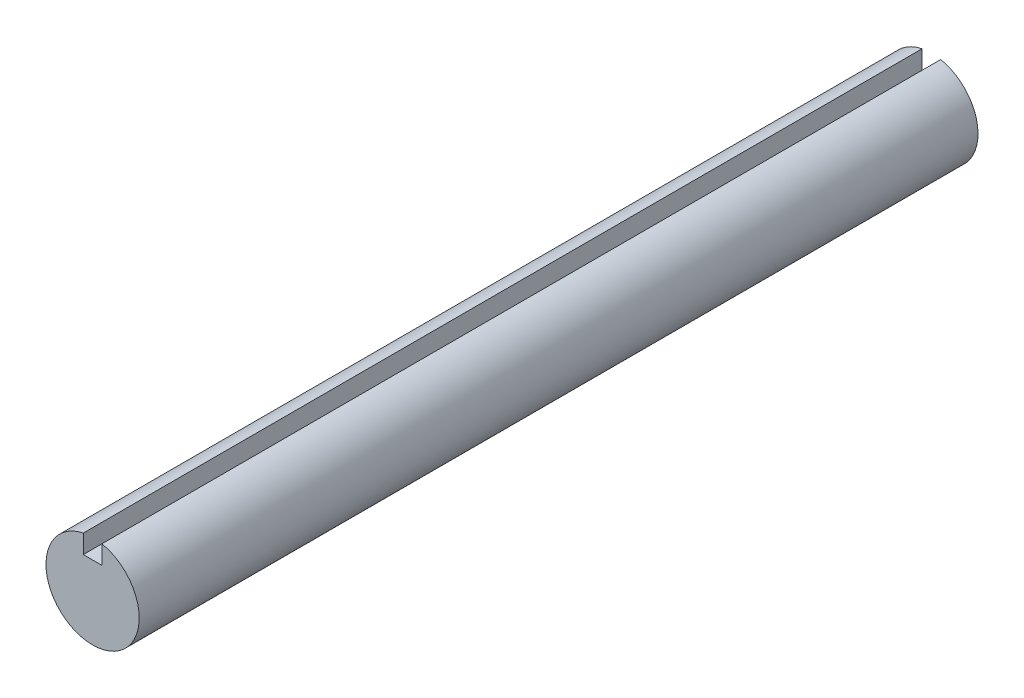
from build123d import *

# Parameters (mm, degrees)
SKETCH1_R           = 3.175
BOSS_EXTRUDE1_DEPTH = 28.575
CUT_EXTRUDE1_DEPTH  = 58.326117521


with BuildPart() as part:
    # Sketch1 → Boss-Extrude1 (new, symmetric)
    with BuildSketch(Plane.XY):
        Circle(SKETCH1_R)
    extrude(amount=BOSS_EXTRUDE1_DEPTH, both=True)

    # Sketch2 → Cut-Extrude1 (cut, through all)
    with BuildSketch(Plane.XY.offset(28.575)):
        with BuildLine():
            Line((-0.635, 3.110851973), (-0.635, 1.840851973))
            Line((-0.635, 1.840851973), (0.635, 1.840851973))
            Line((0.635, 1.840851973), (0.635, 3.110851973))
            ThreePointArc((0.635, 3.110851973), (0, 3.175), (-0.635, 3.110851973))
        make_face()
    extrude(amount=-CUT_EXTRUDE1_DEPTH, mode=Mode.SUBTRACT)


solid = part.part
